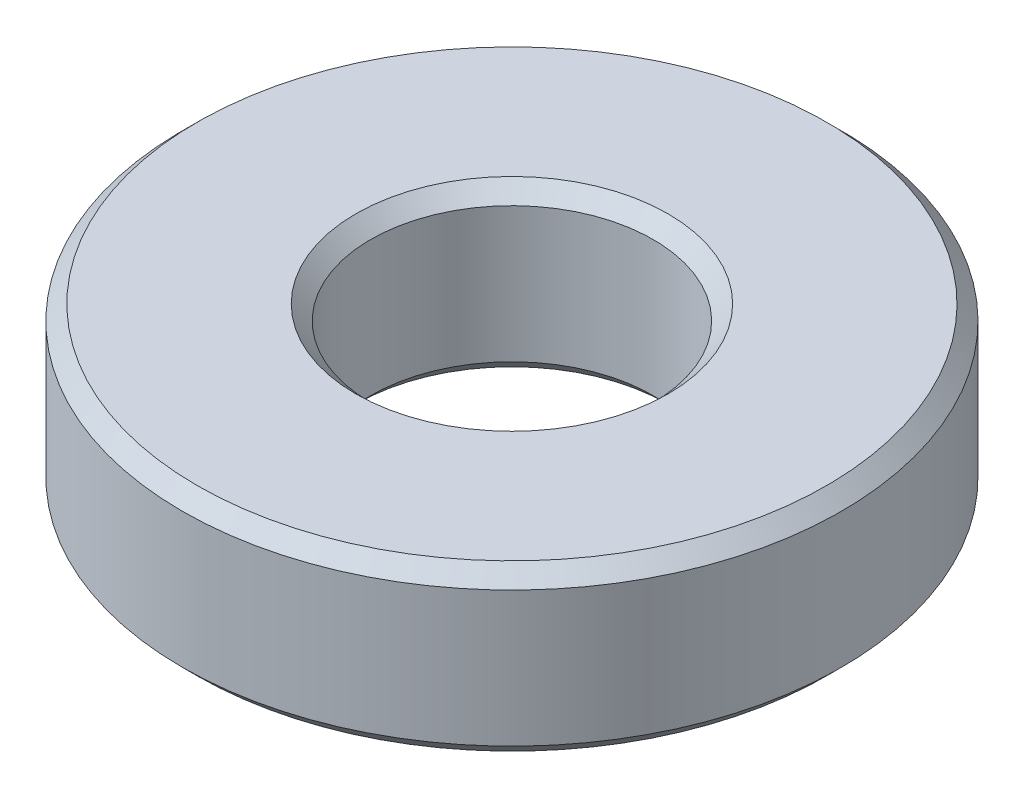
from build123d import *

# Parameters (mm, degrees)
SKETCH1_R           = 11.1125
SKETCH1_R_2         = 4.7625
BOSS_EXTRUDE1_DEPTH = 2.779
CHAMFER1_SIZE       = 0.5


with BuildPart() as part:
    # Sketch1 → Boss-Extrude1 (new, symmetric)
    with BuildSketch(Plane(origin=(0, 0, 0), x_dir=(1, 0, 0), z_dir=(0, 1, 0))):
        Circle(SKETCH1_R)
        Circle(SKETCH1_R_2, mode=Mode.SUBTRACT)
    extrude(amount=BOSS_EXTRUDE1_DEPTH, both=True)

    # Chamfer1
    chamfer1_edges = [part.edges().sort_by_distance(p)[0] for p in [
        (-4.7625, -2.779, 0),
        (-11.1125, -2.779, 0),
        (-4.7625, 2.779, 0),
        (-11.1125, 2.779, 0),
    ]]
    chamfer(chamfer1_edges, length=CHAMFER1_SIZE)


solid = part.part
